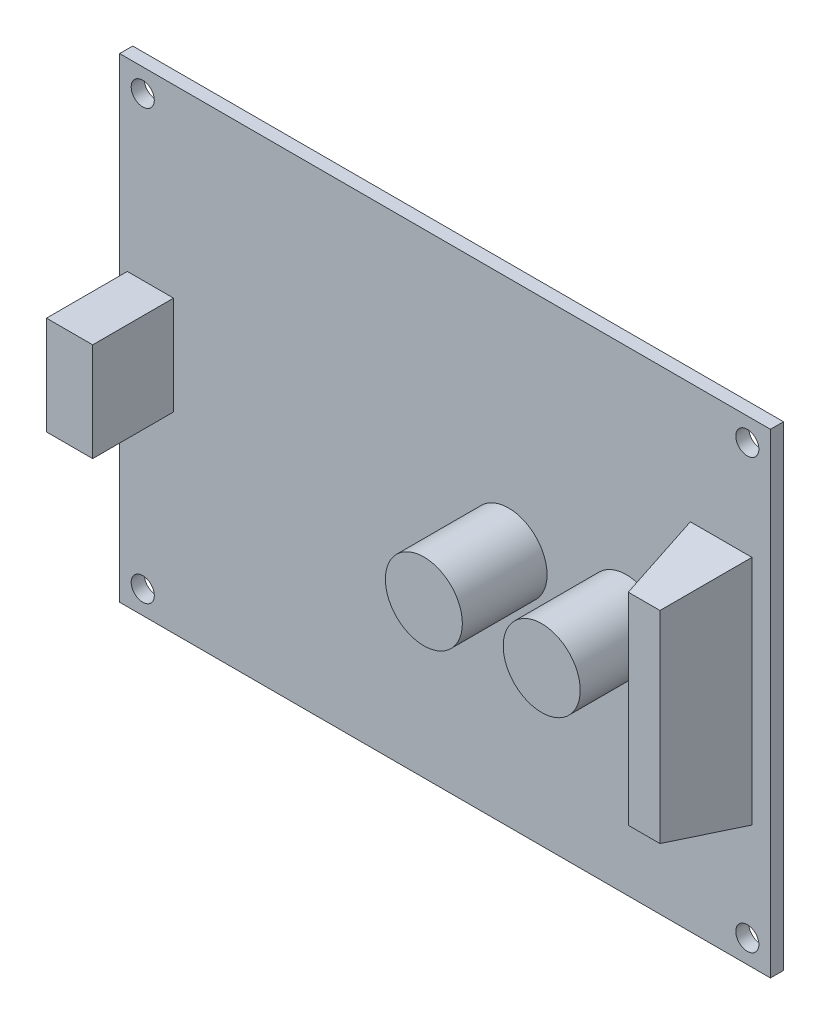
from build123d import *

# Parameters (mm, degrees)
SKETCH1_W           = 84.5
SKETCH1_H           = 61.7
BOSS_EXTRUDE1_DEPTH = 1.7
SKETCH2_W           = 8
SKETCH2_H           = 30.1
BOSS_EXTRUDE2_DEPTH = 10
BOSS_EXTRUDE2_TAPER = 11
SKETCH3_R           = 5
BOSS_EXTRUDE3_DEPTH = 11
SKETCH4_R           = 5
BOSS_EXTRUDE4_DEPTH = 11
SKETCH5_W           = 6
SKETCH5_H           = 12.8
BOSS_EXTRUDE5_DEPTH = 10.5
SKETCH6_R           = 1.5
CUT_EXTRUDE1_DEPTH  = 10
SKETCH7_R           = 1.5
CUT_EXTRUDE2_DEPTH  = 10
SKETCH8_R           = 1.5
CUT_EXTRUDE3_DEPTH  = 10
SKETCH9_R           = 1.5
CUT_EXTRUDE4_DEPTH  = 10


with BuildPart() as part:
    # Sketch1 → Boss-Extrude1 (new body)
    with BuildSketch(Plane.XY):
        with Locations((11.152950311, 11.889984472)):
            Rectangle(SKETCH1_W, SKETCH1_H)
    extrude(amount=BOSS_EXTRUDE1_DEPTH)

    # Sketch2 → Boss-Extrude2 (add)
    with BuildSketch(Plane.XY.offset(1.7)):
        with Locations((47.002950311, 12.089984472)):
            Rectangle(SKETCH2_W, SKETCH2_H)
    extrude(amount=BOSS_EXTRUDE2_DEPTH, taper=BOSS_EXTRUDE2_TAPER)

    # Sketch3 → Boss-Extrude3 (add)
    with BuildSketch(Plane.XY.offset(1.7)):
        with Locations((19.402950311, 11.889984472)):
            Circle(SKETCH3_R)
    extrude(amount=BOSS_EXTRUDE3_DEPTH)

    # Sketch4 → Boss-Extrude4 (add)
    with BuildSketch(Plane.XY.offset(1.7)):
        with Locations((34.702950311, 12.039984472)):
            Circle(SKETCH4_R)
    extrude(amount=BOSS_EXTRUDE4_DEPTH)

    # Sketch5 → Boss-Extrude5 (add)
    with BuildSketch(Plane.XY.offset(1.7)):
        with Locations((-27.097049689, 12.339984472)):
            Rectangle(SKETCH5_W, SKETCH5_H)
    extrude(amount=BOSS_EXTRUDE5_DEPTH)

    # Sketch6 → Cut-Extrude1 (cut)
    with BuildSketch(Plane.XY.offset(1.7)):
        with Locations((-28.097049689, -15.960015528)):
            Circle(SKETCH6_R)
    extrude(amount=-CUT_EXTRUDE1_DEPTH, mode=Mode.SUBTRACT)

    # Sketch7 → Cut-Extrude2 (cut)
    with BuildSketch(Plane.XY.offset(1.7)):
        with Locations((-28.097049689, 39.739984472)):
            Circle(SKETCH7_R)
    extrude(amount=-CUT_EXTRUDE2_DEPTH, mode=Mode.SUBTRACT)

    # Sketch8 → Cut-Extrude3 (cut)
    with BuildSketch(Plane.XY.offset(1.7)):
        with Locations((50.402950311, -15.960015528)):
            Circle(SKETCH8_R)
    extrude(amount=-CUT_EXTRUDE3_DEPTH, mode=Mode.SUBTRACT)

    # Sketch9 → Cut-Extrude4 (cut)
    with BuildSketch(Plane.XY.offset(1.7)):
        with Locations((50.402950311, 39.739984472)):
            Circle(SKETCH9_R)
    extrude(amount=-CUT_EXTRUDE4_DEPTH, mode=Mode.SUBTRACT)


solid = part.part
